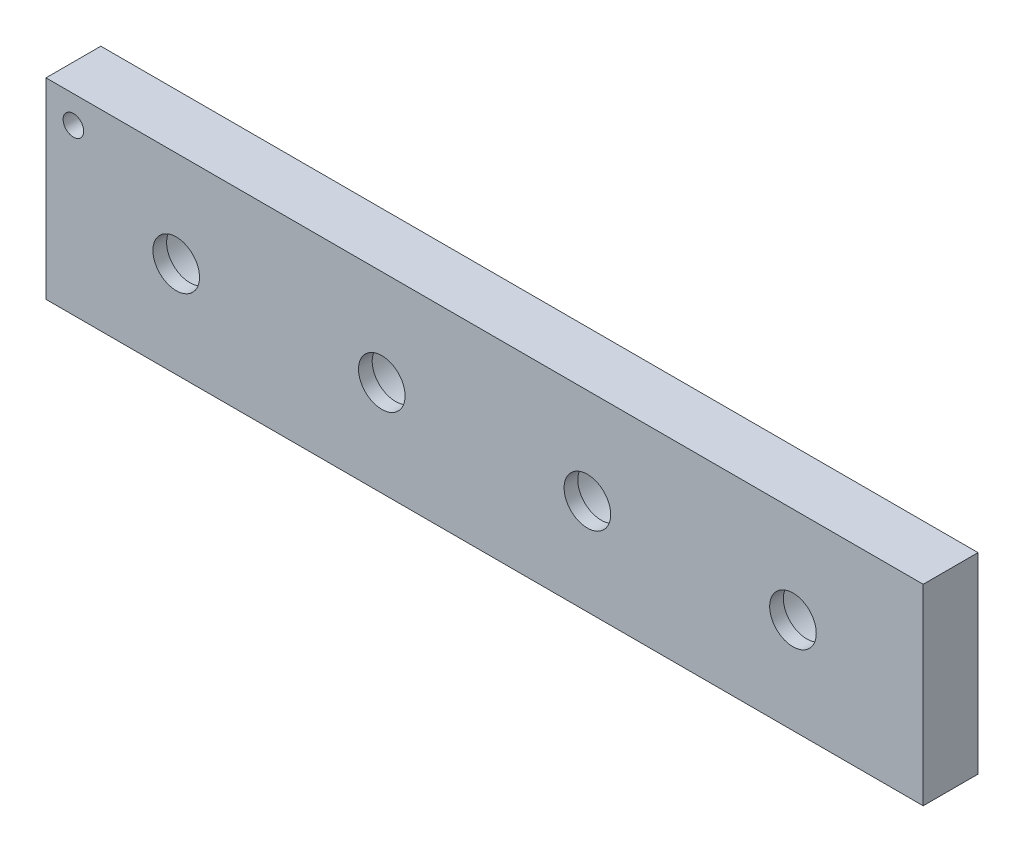
from build123d import *

# Parameters (mm, degrees)
COUPON_BAR_64X14X4_PROFILE_W                   = 64
COUPON_BAR_64X14X4_PROFILE_H                   = 14
COUPON_BAR_64X14X4_DEPTH                       = 4
PRESS_SOCKETS_5P70_5P80_5P90_6P00_DE_2_R       = 2.85
PRESS_SOCKETS_5P70_5P80_5P90_6P00_DE_2_R_2     = 2.9
PRESS_SOCKETS_5P70_5P80_5P90_6P00_DE_2_R_3     = 2.95
PRESS_SOCKETS_5P70_5P80_5P90_6P00_DE_2_R_4     = 3
PRESS_SOCKETS_5P70_5P80_5P90_6P00_DEPTH3_DEPTH = 3
M3_CENTRE_SCREW_CLEARANCE_START                = -50
M3_CENTRE_SCREW_CLEARANCE_PROFILE_R            = 1.7
M3_CENTRE_SCREW_CLEARANCE_DEPTH                = 84
ORIENTATION_MARK_AT_SMALLEST_SOCKET_START      = -50
ORIENTATION_MARK_AT_SMALLEST_SOCKET_PROF_R     = 0.75
ORIENTATION_MARK_AT_SMALLEST_SOCKET_DEPTH      = 84


with BuildPart() as part:
    # Coupon_bar_64x14x4_profile → Coupon_bar_64x14x4 (new body)
    with BuildSketch(Plane.XY):
        Rectangle(COUPON_BAR_64X14X4_PROFILE_W, COUPON_BAR_64X14X4_PROFILE_H)
    extrude(amount=COUPON_BAR_64X14X4_DEPTH)

    # Press_sockets_5p70_5p80_5p90_6p00_de 2 → Press_sockets_5p70_5p80_5p90_6p00_depth3 (cut)
    with BuildSketch(Plane.XY):
        with Locations((-22.5, 0)):
            Circle(PRESS_SOCKETS_5P70_5P80_5P90_6P00_DE_2_R)
        with Locations((-7.5, 0)):
            Circle(PRESS_SOCKETS_5P70_5P80_5P90_6P00_DE_2_R_2)
        with Locations((7.5, 0)):
            Circle(PRESS_SOCKETS_5P70_5P80_5P90_6P00_DE_2_R_3)
        with Locations((22.5, 0)):
            Circle(PRESS_SOCKETS_5P70_5P80_5P90_6P00_DE_2_R_4)
    extrude(amount=PRESS_SOCKETS_5P70_5P80_5P90_6P00_DEPTH3_DEPTH, mode=Mode.SUBTRACT)

    # M3_centre_screw_clearance_profile → M3_centre_screw_clearance (cut, through all)
    with BuildSketch(Plane.XY.offset(M3_CENTRE_SCREW_CLEARANCE_START)):
        with Locations((-22.5, 0)):
            Circle(M3_CENTRE_SCREW_CLEARANCE_PROFILE_R)
        with Locations((-7.5, 0)):
            Circle(M3_CENTRE_SCREW_CLEARANCE_PROFILE_R)
        with Locations((7.5, 0)):
            Circle(M3_CENTRE_SCREW_CLEARANCE_PROFILE_R)
        with Locations((22.5, 0)):
            Circle(M3_CENTRE_SCREW_CLEARANCE_PROFILE_R)
    extrude(amount=M3_CENTRE_SCREW_CLEARANCE_DEPTH, mode=Mode.SUBTRACT)

    # Orientation_mark_at_smallest_socket_profile → Orientation_mark_at_smallest_socket (cut, through all)
    with BuildSketch(Plane.XY.offset(ORIENTATION_MARK_AT_SMALLEST_SOCKET_START)):
        with Locations(Location((-30, 5, 0), (0, 0, 180))):
            Circle(ORIENTATION_MARK_AT_SMALLEST_SOCKET_PROF_R)
    extrude(amount=ORIENTATION_MARK_AT_SMALLEST_SOCKET_DEPTH, mode=Mode.SUBTRACT)


solid = part.part
